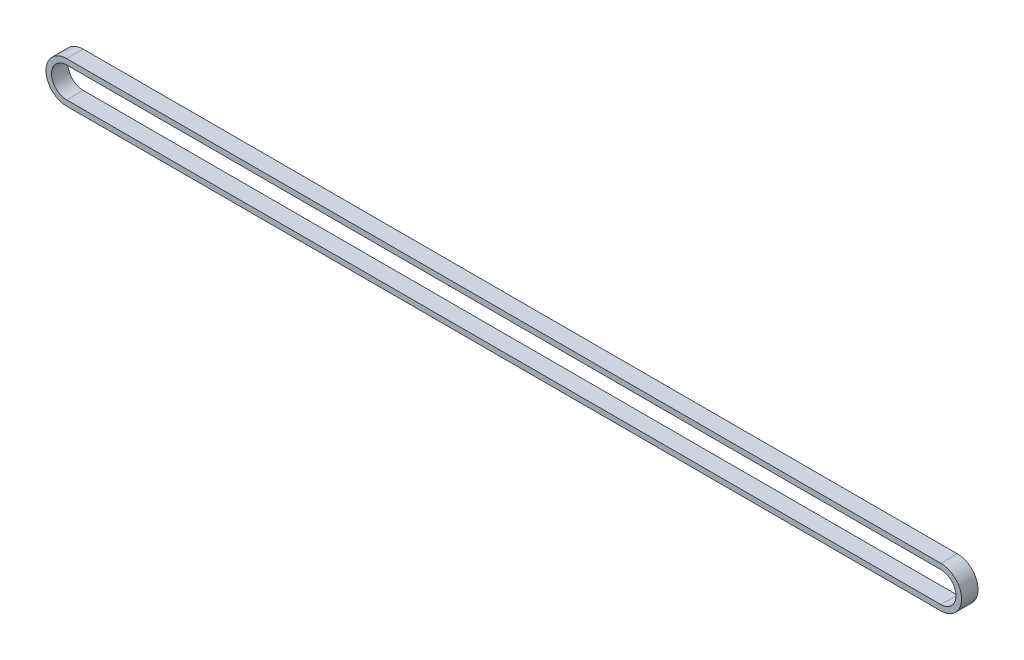
from build123d import *

# Parameters (mm, degrees)
EXTRUDE_1_DEPTH = 6


with BuildPart() as part:
    # 草图1 → 凸台-拉伸1 (new body)
    with BuildSketch(Plane.XY):
        with BuildLine():
            Line((0, 7.5), (318, 7.5))
            ThreePointArc((318, 7.5), (325.5, 0), (318, -7.5))
            Line((318, -7.5), (0, -7.5))
            ThreePointArc((0, -7.5), (-7.5, 0), (0, 7.5))
        make_face()
        with BuildLine():
            Line((0, 5.5), (318, 5.5))
            ThreePointArc((318, 5.5), (323.5, 0), (318, -5.5))
            Line((318, -5.5), (0, -5.5))
            ThreePointArc((0, -5.5), (-5.5, 0), (0, 5.5))
        make_face(mode=Mode.SUBTRACT)
    extrude(amount=EXTRUDE_1_DEPTH)


solid = part.part
